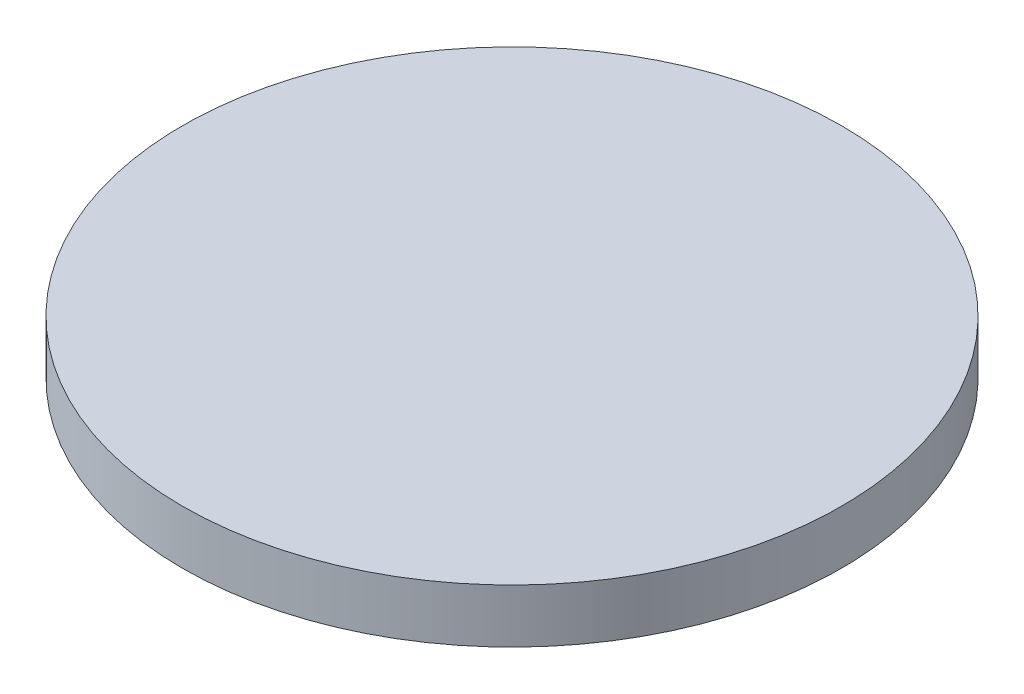
from build123d import *

# Parameters (mm, degrees)
SKETCH1_R           = 101.2
BOSS_EXTRUDE1_DEPTH = 16.51


with BuildPart() as part:
    # Sketch1 → Boss-Extrude1 (new body)
    with BuildSketch(Plane(origin=(0, 0, 0), x_dir=(1, 0, 0), z_dir=(0, 1, 0))):
        with Locations(Location((0, 0, 0), (0, 0, 270))):
            Circle(SKETCH1_R)
    extrude(amount=BOSS_EXTRUDE1_DEPTH)


solid = part.part
